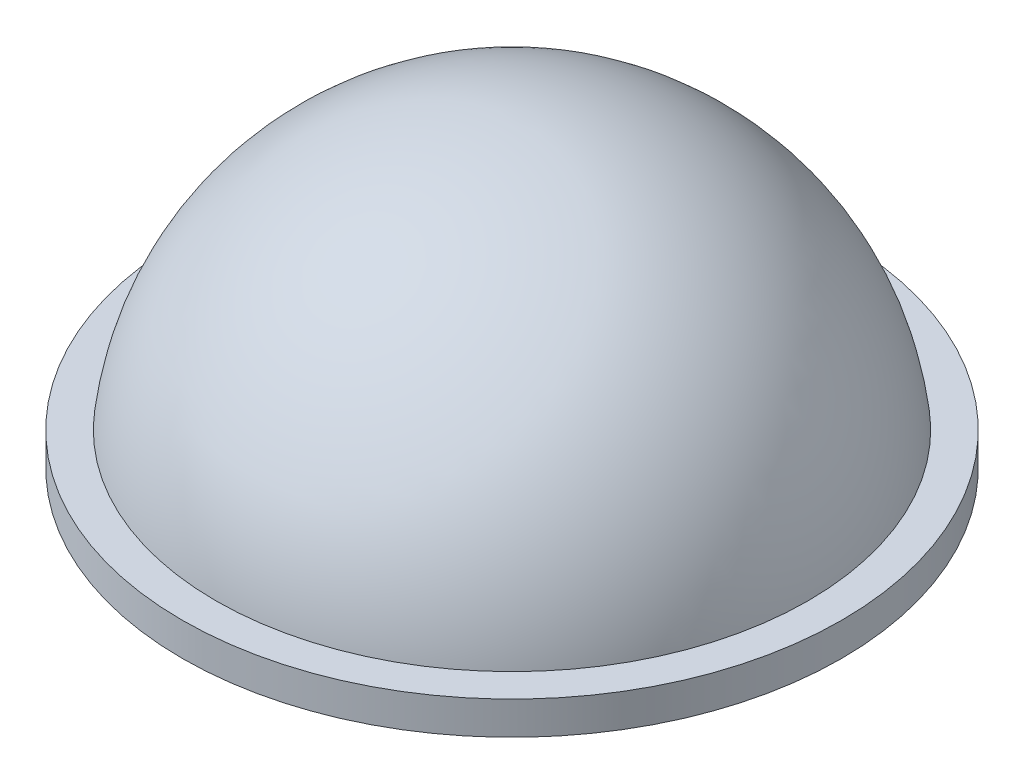
from build123d import *


with BuildPart() as part:
    # 草图1 → 旋转1 (revolve)
    with BuildSketch(Plane.XY, mode=Mode.PRIVATE) as revolve_1_sk:
        with BuildLine():
            Line((-49.8, 0), (-40, 0))
            ThreePointArc((-40, 0), (-28.284271247, 28.284271247), (0, 40))
            Line((0, 40), (0, 45))
            ThreePointArc((0, 45), (-30, 33.541019662), (-44.72135955, 5))
            Line((-44.72135955, 5), (-49.8, 5))
            Line((-49.8, 5), (-49.8, 0))
        make_face()
    revolve(revolve_1_sk.sketch.rotate(Axis((0, 45, 0), (0, -1, 0)), 180), axis=Axis((0, 45, 0), (0, -1, 0)))


solid = part.part
